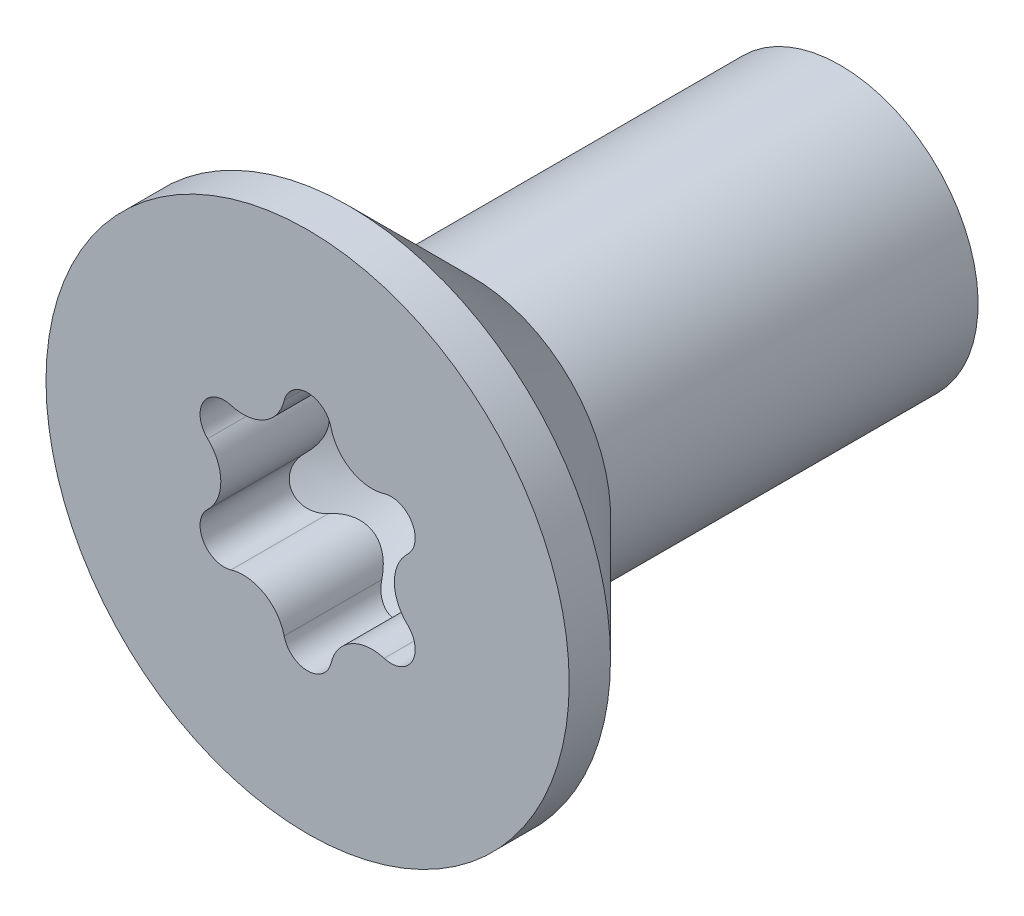
from build123d import *

# Parameters (mm, degrees)
HEXALOBULAR_REACH = 6.819


with BuildPart() as part:
    # BodySke → Base-Revolve (revolve)
    with BuildSketch(Plane(origin=(0, 0, 0), x_dir=(0, 0, -1), z_dir=(1, 0, 0)), mode=Mode.PRIVATE) as base_revolve_sk:
        Polygon((0, 0), (0, 1.9), (0.3, 1.9), (1.2, 1), (4, 1), (4, 0), align=None)
    revolve(base_revolve_sk.sketch.rotate(Axis((0, 0, 0), (0, 0, 1)), 90), axis=Axis((0, 0, 0), (0, 0, 1)))

    # PreBSke → PreBroach (revolve, cut)
    with BuildSketch(Plane(origin=(0, 0, 0), x_dir=(0, 0, -1), z_dir=(1, 0, 0)), mode=Mode.PRIVATE) as prebroach_sk:
        Polygon((0, 0), (0, 0.875), (0.64, 0.875), (1.165753042, 0), align=None)
    revolve(prebroach_sk.sketch.rotate(Axis((0, 0, 0), (0, 0, 1)), 90), axis=Axis((0, 0, 0), (0, 0, 1)), mode=Mode.SUBTRACT)

    # Hexalobular: up to this cone (the profile starts inside it)
    hexalobular_end = Plane(origin=(0, 0, 0), z_dir=(0, 0, 1)).offset(-1.165752042) * Cone(1.664e-06, 17.349933712, 10.42489091, align=(Align.CENTER, Align.CENTER, Align.MIN), mode=Mode.PRIVATE)
    # HexSke → Hexalobular (add, up to the surface)
    with BuildSketch(Plane.XY, mode=Mode.PRIVATE) as hexalobular_sk1:
        with BuildLine():
            ThreePointArc((-0.757772228, -0.4375), (-0.779371934, -0.324649655), (-0.726328785, -0.222727273))
            ThreePointArc((-0.726328785, -0.222727273), (-0.630273039, 0), (-0.726328785, 0.222727273))
            ThreePointArc((-0.726328785, 0.222727273), (-0.779371934, 0.324649655), (-0.757772228, 0.4375))
            ThreePointArc((-0.757772228, 0.4375), (-0.875, 0), (-0.757772228, -0.4375))
        make_face()
    hexalobular_tool1 = extrude(hexalobular_sk1.sketch, amount=-HEXALOBULAR_REACH, mode=Mode.PRIVATE) & hexalobular_end
    add(hexalobular_tool1.solids().sort_by_distance((-0.76612, 0, 0))[0])
    # HexSke → Hexalobular (add, up to the surface)
    with BuildSketch(Plane.XY, mode=Mode.PRIVATE) as hexalobular_sk2:
        with BuildLine():
            ThreePointArc((0, 0.875), (-0.4375, 0.757772228), (-0.757772228, 0.4375))
            ThreePointArc((-0.757772228, 0.4375), (-0.670840815, 0.512631066), (-0.556051869, 0.517655543))
            ThreePointArc((-0.556051869, 0.517655543), (-0.31513652, 0.545832463), (-0.170276916, 0.740382816))
            ThreePointArc((-0.170276916, 0.740382816), (-0.108531118, 0.837280721), (0, 0.875))
        make_face()
    hexalobular_tool2 = extrude(hexalobular_sk2.sketch, amount=-HEXALOBULAR_REACH, mode=Mode.PRIVATE) & hexalobular_end
    add(hexalobular_tool2.solids().sort_by_distance((-0.38306, 0.66348, 0))[0])
    # HexSke → Hexalobular (add, up to the surface)
    with BuildSketch(Plane.XY, mode=Mode.PRIVATE) as hexalobular_sk3:
        with BuildLine():
            ThreePointArc((0.757772228, 0.4375), (0.4375, 0.757772228), (0, 0.875))
            ThreePointArc((0, 0.875), (0.108531118, 0.837280721), (0.170276916, 0.740382816))
            ThreePointArc((0.170276916, 0.740382816), (0.31513652, 0.545832463), (0.556051869, 0.517655543))
            ThreePointArc((0.556051869, 0.517655543), (0.670840815, 0.512631066), (0.757772228, 0.4375))
        make_face()
    hexalobular_tool3 = extrude(hexalobular_sk3.sketch, amount=-HEXALOBULAR_REACH, mode=Mode.PRIVATE) & hexalobular_end
    add(hexalobular_tool3.solids().sort_by_distance((0.38306, 0.66348, 0))[0])
    # HexSke → Hexalobular (add, up to the surface)
    with BuildSketch(Plane.XY, mode=Mode.PRIVATE) as hexalobular_sk4:
        with BuildLine():
            ThreePointArc((0.726328785, -0.222727273), (0.779371934, -0.324649655), (0.757772228, -0.4375))
            ThreePointArc((0.757772228, -0.4375), (0.845185098, -0.226466664), (0.875, 0))
            ThreePointArc((0.875, 0), (0.845185098, 0.226466664), (0.757772228, 0.4375))
            ThreePointArc((0.757772228, 0.4375), (0.779371934, 0.324649655), (0.726328785, 0.222727273))
            ThreePointArc((0.726328785, 0.222727273), (0.630273039, 0), (0.726328785, -0.222727273))
        make_face()
    hexalobular_tool4 = extrude(hexalobular_sk4.sketch, amount=-HEXALOBULAR_REACH, mode=Mode.PRIVATE) & hexalobular_end
    add(hexalobular_tool4.solids().sort_by_distance((0.76612, 0, 0))[0])
    # HexSke → Hexalobular (add, up to the surface)
    with BuildSketch(Plane.XY, mode=Mode.PRIVATE) as hexalobular_sk5:
        with BuildLine():
            ThreePointArc((0.170276916, -0.740382816), (0.108531118, -0.837280721), (0, -0.875))
            ThreePointArc((0, -0.875), (0.4375, -0.757772228), (0.757772228, -0.4375))
            ThreePointArc((0.757772228, -0.4375), (0.670840815, -0.512631066), (0.556051869, -0.517655543))
            ThreePointArc((0.556051869, -0.517655543), (0.31513652, -0.545832463), (0.170276916, -0.740382816))
        make_face()
    hexalobular_tool5 = extrude(hexalobular_sk5.sketch, amount=-HEXALOBULAR_REACH, mode=Mode.PRIVATE) & hexalobular_end
    add(hexalobular_tool5.solids().sort_by_distance((0.38306, -0.66348, 0))[0])
    # HexSke → Hexalobular (add, up to the surface)
    with BuildSketch(Plane.XY, mode=Mode.PRIVATE) as hexalobular_sk6:
        with BuildLine():
            ThreePointArc((-0.556051869, -0.517655543), (-0.670840815, -0.512631066), (-0.757772228, -0.4375))
            ThreePointArc((-0.757772228, -0.4375), (-0.4375, -0.757772228), (0, -0.875))
            ThreePointArc((0, -0.875), (-0.108531118, -0.837280721), (-0.170276916, -0.740382816))
            ThreePointArc((-0.170276916, -0.740382816), (-0.31513652, -0.545832463), (-0.556051869, -0.517655543))
        make_face()
    hexalobular_tool6 = extrude(hexalobular_sk6.sketch, amount=-HEXALOBULAR_REACH, mode=Mode.PRIVATE) & hexalobular_end
    add(hexalobular_tool6.solids().sort_by_distance((-0.38306, -0.66348, 0))[0])

    # ThdSchSke → ThreadSchematic (revolve, cut)
    with BuildSketch(Plane(origin=(0, 0, 0), x_dir=(0, 0, -1), z_dir=(1, 0, 0))):
        Polygon((4.130481161, 1), (4, 0.774), (3.869518839, 1), align=None)
    revolve(axis=Axis((0, 0, 0), (0, 0, 1)), mode=Mode.SUBTRACT)


solid = part.part
